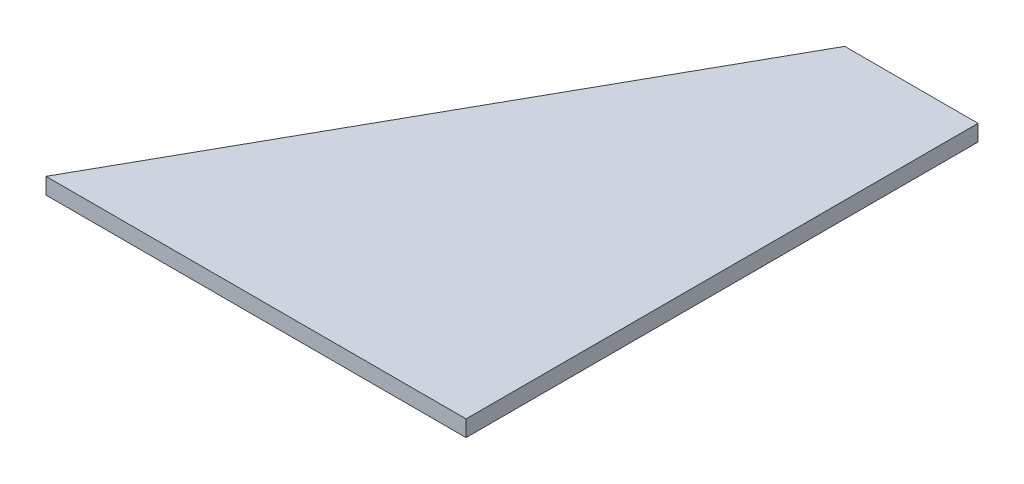
from build123d import *

# Parameters (mm, degrees)
BOSS_EXTRUDE1_DEPTH = 10


with BuildPart() as part:
    # Sketch1 → Boss-Extrude1 (new body)
    with BuildSketch(Plane(origin=(0, 0, 0), x_dir=(1, 0, 0), z_dir=(0, 1, 0))):
        Polygon((-49.430422288, 66.045854421), (32.569577712, 66.045854421), (32.569577712, -248.954145579), (-225.902961689, -248.954145579), align=None)
    extrude(amount=BOSS_EXTRUDE1_DEPTH)


solid = part.part
